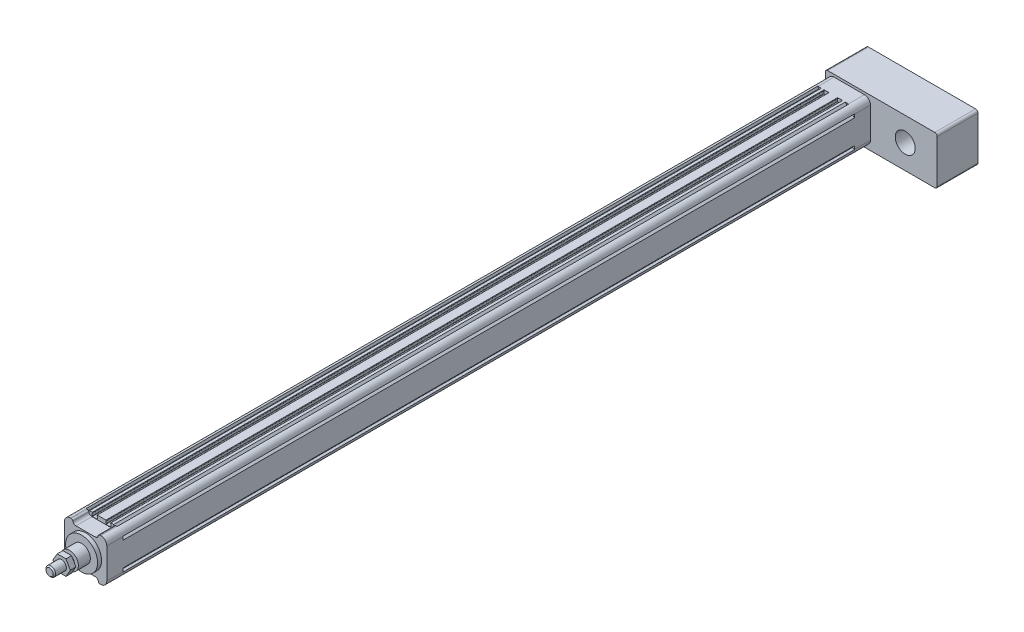
from build123d import *

# Parameters (mm, degrees)
SKETCH_1_R                  = 2.1
EXTRUDE_1_DEPTH             = 915
EXTRUDE_2_DEPTH             = 20
SKETCH_7_R                  = 20
EXTRUDE_3_DEPTH             = 5
SKETCH_9_R                  = 11
EXTRUDE_4_DEPTH             = 15
SKETCH_10_R                 = 6
EXTRUDE_5_DEPTH             = 25
EXTRUDE_START               = 20
EXTRUDE_6_DEPTH             = 20
EXTRUDE_7_DEPTH             = 51
SKETCH_13_R                 = 12.5
CUT_EXTRUDE_2_DEPTH         = 30
PATTERN_LINEAR_1_COUNT      = 2
PATTERN_LINEAR_1_PITCH      = 38
PATTERN_LINEAR_1_COUNT_DIR2 = 2
PATTERN_LINEAR_1_PITCH_DIR2 = 38
HOLE_WIZARD_M6_2_D          = 5
HOLE_WIZARD_M6_2_DEPTH      = 15
HOLE_WIZARD_M6_2_TIP        = 1.502151548
HOLE_WIZARD_M6_3_D          = 5
HOLE_WIZARD_M6_3_DEPTH      = 15
HOLE_WIZARD_M6_3_TIP        = 1.502151548
HOLE_WIZARD_M6_4_D          = 5
HOLE_WIZARD_M6_4_DEPTH      = 15
HOLE_WIZARD_M6_4_TIP        = 1.502151548
CHAMFER_1_SIZE              = 1.5
EXTRUDE_START_2             = 3
EXTRUDE_8_DEPTH             = 7


with BuildPart() as part:
    # 草图1 → 凸台-拉伸1 (new body)
    with BuildSketch(Plane.XY):
        with BuildLine():
            Line((-18.2, 24), (-19.443439638, 26.486879276))
            ThreePointArc((-19.443439638, 26.486879276), (-24.303300859, 24.303300859), (-26.486879276, 19.443439638))
            Line((-26.486879276, 19.443439638), (-24, 18.2))
            Line((-24, 18.2), (-24, 17.1))
            Line((-24, 17.1), (-26.5, 15))
            Line((-26.5, 15), (-26.5, -15))
            Line((-26.5, -15), (-24, -17.1))
            Line((-24, -17.1), (-24, -18.2))
            Line((-24, -18.2), (-26.486879276, -19.443439638))
            ThreePointArc((-26.486879276, -19.443439638), (-24.303300859, -24.303300859), (-19.443439638, -26.486879276))
            Line((-19.443439638, -26.486879276), (-18.2, -24))
            Line((-18.2, -24), (-17.1, -24))
            Line((-17.1, -24), (-15, -26.5))
            Line((-15, -26.5), (-11.65, -26.5))
            ThreePointArc((-11.65, -26.5), (-11.367157288, -26.382842712), (-11.25, -26.1))
            Line((-11.25, -26.1), (-11.25, -25.6))
            ThreePointArc((-11.25, -25.6), (-11.367157288, -25.317157288), (-11.65, -25.2))
            Line((-11.65, -25.2), (-11.75, -25.2))
            Line((-11.75, -25.2), (-11.75, -22.4))
            ThreePointArc((-11.75, -22.4), (-11.632842712, -22.117157288), (-11.35, -22))
            Line((-11.35, -22), (-5.65, -22))
            ThreePointArc((-5.65, -22), (-5.367157288, -22.117157288), (-5.25, -22.4))
            Line((-5.25, -22.4), (-5.25, -25.2))
            Line((-5.25, -25.2), (-5.35, -25.2))
            ThreePointArc((-5.35, -25.2), (-5.632842712, -25.317157288), (-5.75, -25.6))
            Line((-5.75, -25.6), (-5.75, -26.1))
            ThreePointArc((-5.75, -26.1), (-5.632842712, -26.382842712), (-5.35, -26.5))
            Line((-5.35, -26.5), (5.35, -26.5))
            ThreePointArc((5.35, -26.5), (5.632842712, -26.382842712), (5.75, -26.1))
            Line((5.75, -26.1), (5.75, -25.6))
            ThreePointArc((5.75, -25.6), (5.632842712, -25.317157288), (5.35, -25.2))
            Line((5.35, -25.2), (5.25, -25.2))
            Line((5.25, -25.2), (5.25, -22.4))
            ThreePointArc((5.25, -22.4), (5.367157288, -22.117157288), (5.65, -22))
            Line((5.65, -22), (11.35, -22))
            ThreePointArc((11.35, -22), (11.632842712, -22.117157288), (11.75, -22.4))
            Line((11.75, -22.4), (11.75, -25.2))
            Line((11.75, -25.2), (11.65, -25.2))
            ThreePointArc((11.65, -25.2), (11.367157288, -25.317157288), (11.25, -25.6))
            Line((11.25, -25.6), (11.25, -26.1))
            ThreePointArc((11.25, -26.1), (11.367157288, -26.382842712), (11.65, -26.5))
            Line((11.65, -26.5), (15, -26.5))
            Line((15, -26.5), (17.1, -24))
            Line((17.1, -24), (18.2, -24))
            Line((18.2, -24), (19.443439638, -26.486879276))
            ThreePointArc((19.443439638, -26.486879276), (24.303300859, -24.303300859), (26.486879276, -19.443439638))
            Line((26.486879276, -19.443439638), (24, -18.2))
            Line((24, -18.2), (24, -17.1))
            Line((24, -17.1), (26.5, -15))
            Line((26.5, -15), (26.5, 15))
            Line((26.5, 15), (24, 17.1))
            Line((24, 17.1), (24, 18.2))
            Line((24, 18.2), (26.486879276, 19.443439638))
            ThreePointArc((26.486879276, 19.443439638), (24.303300859, 24.303300859), (19.443439638, 26.486879276))
            Line((19.443439638, 26.486879276), (18.2, 24))
            Line((18.2, 24), (17.1, 24))
            Line((17.1, 24), (15, 26.5))
            Line((15, 26.5), (11.65, 26.5))
            ThreePointArc((11.65, 26.5), (11.367157288, 26.382842712), (11.25, 26.1))
            Line((11.25, 26.1), (11.25, 25.6))
            ThreePointArc((11.25, 25.6), (11.367157288, 25.317157288), (11.65, 25.2))
            Line((11.65, 25.2), (11.75, 25.2))
            Line((11.75, 25.2), (11.75, 22.4))
            ThreePointArc((11.75, 22.4), (11.632842712, 22.117157288), (11.35, 22))
            Line((11.35, 22), (5.65, 22))
            ThreePointArc((5.65, 22), (5.367157288, 22.117157288), (5.25, 22.4))
            Line((5.25, 22.4), (5.25, 25.2))
            Line((5.25, 25.2), (5.35, 25.2))
            ThreePointArc((5.35, 25.2), (5.632842712, 25.317157288), (5.75, 25.6))
            Line((5.75, 25.6), (5.75, 26.1))
            ThreePointArc((5.75, 26.1), (5.632842712, 26.382842712), (5.35, 26.5))
            Line((5.35, 26.5), (-5.35, 26.5))
            ThreePointArc((-5.35, 26.5), (-5.632842712, 26.382842712), (-5.75, 26.1))
            Line((-5.75, 26.1), (-5.75, 25.6))
            ThreePointArc((-5.75, 25.6), (-5.632842712, 25.317157288), (-5.35, 25.2))
            Line((-5.35, 25.2), (-5.25, 25.2))
            Line((-5.25, 25.2), (-5.25, 22.4))
            ThreePointArc((-5.25, 22.4), (-5.367157288, 22.117157288), (-5.65, 22))
            Line((-5.65, 22), (-11.35, 22))
            ThreePointArc((-11.35, 22), (-11.632842712, 22.117157288), (-11.75, 22.4))
            Line((-11.75, 22.4), (-11.75, 25.2))
            Line((-11.75, 25.2), (-11.65, 25.2))
            ThreePointArc((-11.65, 25.2), (-11.367157288, 25.317157288), (-11.25, 25.6))
            Line((-11.25, 25.6), (-11.25, 26.1))
            ThreePointArc((-11.25, 26.1), (-11.367157288, 26.382842712), (-11.65, 26.5))
            Line((-11.65, 26.5), (-15, 26.5))
            Line((-15, 26.5), (-17.1, 24))
            Line((-17.1, 24), (-18.2, 24))
        make_face()
        with Locations(Location((19, 19, 0), (0, 0, 180))):
            Circle(SKETCH_1_R, mode=Mode.SUBTRACT)
        with Locations(Location((19, -19, 0), (0, 0, 180))):
            Circle(SKETCH_1_R, mode=Mode.SUBTRACT)
        with Locations(Location((-19, -19, 0), (0, 0, 180))):
            Circle(SKETCH_1_R, mode=Mode.SUBTRACT)
        with Locations(Location((-19, 19, 0), (0, 0, 180))):
            Circle(SKETCH_1_R, mode=Mode.SUBTRACT)
        with BuildLine():
            Line((19.773719933, 3), (23.3, 3))
            Line((23.3, 3), (23.3, -3))
            Line((23.3, -3), (19.773719933, -3))
            ThreePointArc((19.773719933, -3), (0, -20), (-19.773719933, -3))
            Line((-19.773719933, -3), (-23.3, -3))
            Line((-23.3, -3), (-23.3, 3))
            Line((-23.3, 3), (-19.773719933, 3))
            ThreePointArc((-19.773719933, 3), (0, 20), (19.773719933, 3))
        make_face(mode=Mode.SUBTRACT)
    extrude(amount=EXTRUDE_1_DEPTH)

    # 草图6 → 凸台-拉伸2 (add)
    with BuildSketch(Plane.XY.offset(915)):
        with BuildLine():
            Line((-26.5, -19), (-26.5, 19))
            ThreePointArc((-26.5, 19), (-24.303300859, 24.303300859), (-19, 26.5))
            Line((-19, 26.5), (-17.916079783, 26.5))
            ThreePointArc((-17.916079783, 26.5), (-16.625085334, 26.027525232), (-15.944053189, 24.833333333))
            ThreePointArc((-15.944053189, 24.833333333), (-14.581988897, 22.444949537), (-12, 21.5))
            Line((-12, 21.5), (12, 21.5))
            ThreePointArc((12, 21.5), (14.581988897, 22.444949537), (15.944053189, 24.833333333))
            ThreePointArc((15.944053189, 24.833333333), (16.625085334, 26.027525232), (17.916079783, 26.5))
            Line((17.916079783, 26.5), (19, 26.5))
            ThreePointArc((19, 26.5), (24.303300859, 24.303300859), (26.5, 19))
            Line((26.5, 19), (26.5, -19))
            ThreePointArc((26.5, -19), (24.303300859, -24.303300859), (19, -26.5))
            Line((19, -26.5), (17.916079783, -26.5))
            ThreePointArc((17.916079783, -26.5), (16.625085334, -26.027525232), (15.944053189, -24.833333333))
            ThreePointArc((15.944053189, -24.833333333), (14.581988897, -22.444949537), (12, -21.5))
            Line((12, -21.5), (-12, -21.5))
            ThreePointArc((-12, -21.5), (-14.581988897, -22.444949537), (-15.944053189, -24.833333333))
            ThreePointArc((-15.944053189, -24.833333333), (-16.625085334, -26.027525232), (-17.916079783, -26.5))
            Line((-17.916079783, -26.5), (-19, -26.5))
            ThreePointArc((-19, -26.5), (-24.303300859, -24.303300859), (-26.5, -19))
        make_face()
    extrude(amount=EXTRUDE_2_DEPTH)

    # 草图7 → 凸台-拉伸3 (add)
    with BuildSketch(Plane.XY.offset(935)):
        Circle(SKETCH_7_R)
    extrude(amount=EXTRUDE_3_DEPTH)

    # 草图9 → 凸台-拉伸4 (add)
    with BuildSketch(Plane.XY.offset(940)):
        Circle(SKETCH_9_R)
    extrude(amount=EXTRUDE_4_DEPTH)

    # 草图10 → 凸台-拉伸5 (add)
    with BuildSketch(Plane.XY.offset(955)):
        Circle(SKETCH_10_R)
    extrude(amount=EXTRUDE_5_DEPTH)

    # 草图11 → 凸台-拉伸6 (add)
    with BuildSketch(Plane(origin=(0, 0, 0), x_dir=(-1, 0, 0), z_dir=(0, 0, -1)).offset(EXTRUDE_START)):
        with BuildLine():
            Line((-19, -26.5), (19, -26.5))
            ThreePointArc((19, -26.5), (24.303300859, -24.303300859), (26.5, -19))
            Line((26.5, -19), (26.5, 19))
            ThreePointArc((26.5, 19), (24.303300859, 24.303300859), (19, 26.5))
            Line((19, 26.5), (-19, 26.5))
            ThreePointArc((-19, 26.5), (-24.303300859, 24.303300859), (-26.5, 19))
            Line((-26.5, 19), (-26.5, -19))
            ThreePointArc((-26.5, -19), (-24.303300859, -24.303300859), (-19, -26.5))
        make_face()
    extrude(amount=-EXTRUDE_6_DEPTH)

    # 草图12 → 凸台-拉伸7 (add)
    with BuildSketch(Plane(origin=(0, 0, -20), x_dir=(-1, 0, 0), z_dir=(0, 0, -1))):
        with BuildLine():
            Line((-107, -30.404162038), (27, -30.404162038))
            ThreePointArc((27, -30.404162038), (29.121320344, -29.525482382), (30, -27.404162038))
            Line((30, -27.404162038), (30, 26.595837962))
            ThreePointArc((30, 26.595837962), (29.121320344, 28.717158305), (27, 29.595837962))
            Line((27, 29.595837962), (-107, 29.595837962))
            ThreePointArc((-107, 29.595837962), (-109.121320344, 28.717158305), (-110, 26.595837962))
            Line((-110, 26.595837962), (-110, -27.404162038))
            ThreePointArc((-110, -27.404162038), (-109.121320344, -29.525482382), (-107, -30.404162038))
        make_face()
    extrude(amount=EXTRUDE_7_DEPTH)

    # 草图13 → 切除-拉伸2 (cut)
    with BuildSketch(Plane.XY.offset(-20)):
        with Locations((70, 0)):
            Circle(SKETCH_13_R)
    extrude(amount=-CUT_EXTRUDE_2_DEPTH, mode=Mode.SUBTRACT)

    # 草图15 → M6 螺纹孔1 (revolve, cut)
    with BuildSketch(Plane(origin=(-19, -19, -71), x_dir=(0, 1, 0), z_dir=(1, 0, 0))):
        Polygon((0, 0), (0, 16.502151548), (2.5, 15), (2.5, 0), align=None)
    hole_wizard_m6_1 = revolve(axis=Axis((-19, -19, -77.35), (0, 0, 1)), mode=Mode.SUBTRACT)

    # 阵列(线性)1: Hole Wizard M6 _1 2 × 2
    with Locations(*[(j * PATTERN_LINEAR_1_PITCH_DIR2, i * PATTERN_LINEAR_1_PITCH, 0) for i in range(PATTERN_LINEAR_1_COUNT) for j in range(PATTERN_LINEAR_1_COUNT_DIR2) if (i, j) != (0, 0)]):
        add(hole_wizard_m6_1, mode=Mode.SUBTRACT)

    # M6 螺纹孔2
    with Locations(Plane(origin=(0, 0, -71), x_dir=(-1, 0, 0), z_dir=(0, 0, -1))):
        with Locations((-84, -19), (-84, 19)):
            Hole(HOLE_WIZARD_M6_2_D / 2, depth=HOLE_WIZARD_M6_2_DEPTH)
            with Locations((0, 0, -(HOLE_WIZARD_M6_2_DEPTH + HOLE_WIZARD_M6_2_TIP / 2))):  # 118° drill point
                Cone(0, HOLE_WIZARD_M6_2_D / 2, HOLE_WIZARD_M6_2_TIP, mode=Mode.SUBTRACT)

    # M6 螺纹孔3
    with Locations(Plane.ZY.offset(26.5)):
        with Locations((925, 11), (925, -11)):
            Hole(HOLE_WIZARD_M6_3_D / 2, depth=HOLE_WIZARD_M6_3_DEPTH)
            with Locations((0, 0, -(HOLE_WIZARD_M6_3_DEPTH + HOLE_WIZARD_M6_3_TIP / 2))):  # 118° drill point
                Cone(0, HOLE_WIZARD_M6_3_D / 2, HOLE_WIZARD_M6_3_TIP, mode=Mode.SUBTRACT)

    # M6 螺纹孔4
    with Locations(Plane.ZY.offset(26.5)):
        with Locations((-10, 11), (-10, -11)):
            Hole(HOLE_WIZARD_M6_4_D / 2, depth=HOLE_WIZARD_M6_4_DEPTH)
            with Locations((0, 0, -(HOLE_WIZARD_M6_4_DEPTH + HOLE_WIZARD_M6_4_TIP / 2))):  # 118° drill point
                Cone(0, HOLE_WIZARD_M6_4_D / 2, HOLE_WIZARD_M6_4_TIP, mode=Mode.SUBTRACT)

    # 倒角1
    chamfer_1_edges = [part.edges().sort_by_distance(p)[0] for p in [
        (-6, 0, 980),
    ]]
    chamfer(chamfer_1_edges, length=CHAMFER_1_SIZE)

    # 草图23 → 凸台-拉伸8 (add)
    with BuildSketch(Plane.XY.offset(955).offset(EXTRUDE_START_2)):
        Polygon((10.969655115, 0), (5.484827557, 9.5), (-5.484827557, 9.5), (-10.969655115, 0), (-5.484827557, -9.5), (5.484827557, -9.5), align=None)
    extrude(amount=EXTRUDE_8_DEPTH)


solid = part.part
